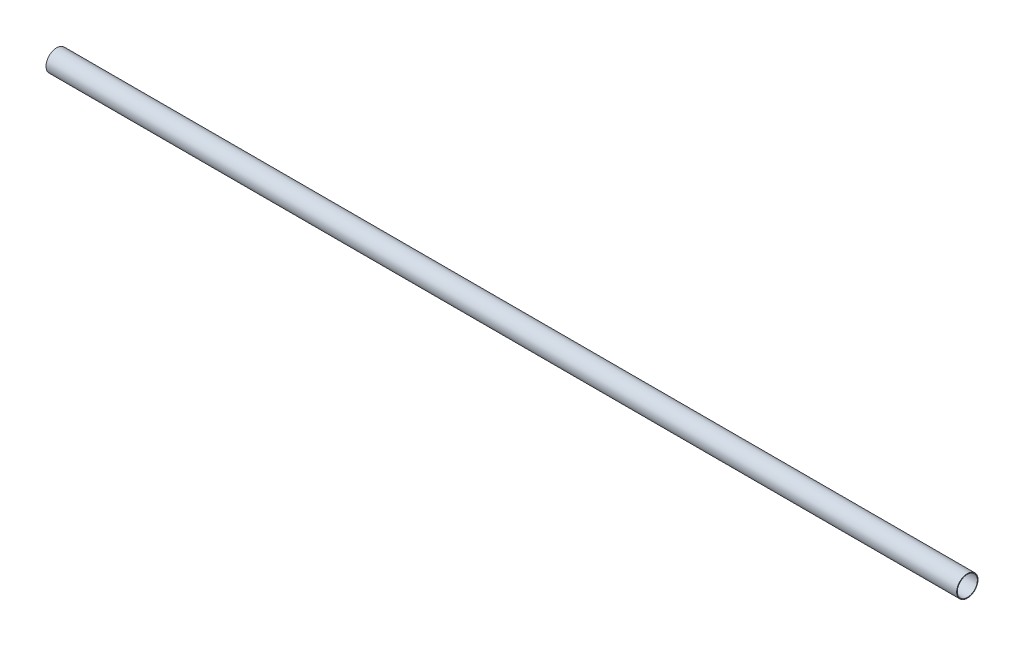
from build123d import *

# Parameters (mm, degrees)
SKETCH1_R      = 14.2875
SKETCH1_R_2    = 13.3985
EXTRUDE1_DEPTH = 609.6


with BuildPart() as part:
    # Sketch1 → Extrude1 (new, symmetric)
    with BuildSketch(Plane(origin=(0, 0, 0), x_dir=(0, 0, -1), z_dir=(1, 0, 0))):
        with Locations(Location((0, 0, 0), (0, 0, 180))):
            Circle(SKETCH1_R)
        with Locations(Location((0, 0, 0), (0, 0, 180))):
            Circle(SKETCH1_R_2, mode=Mode.SUBTRACT)
    extrude(amount=EXTRUDE1_DEPTH, both=True)


solid = part.part
